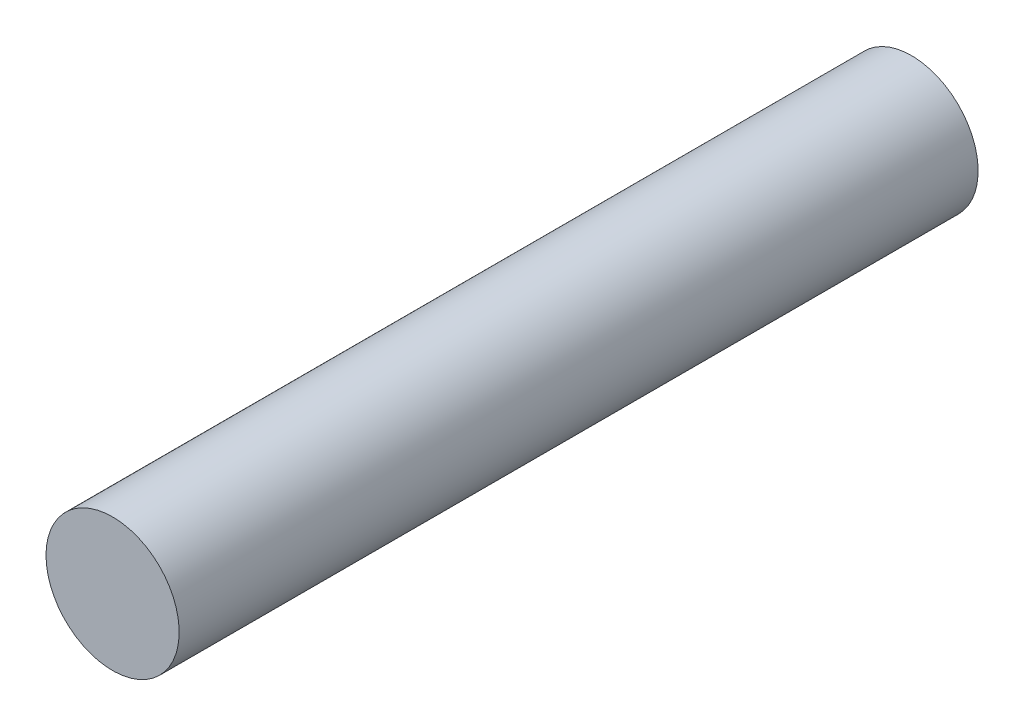
from build123d import *

# Parameters (mm, degrees)
ESQUISSE1_R        = 3.175
BOSS_EXTRU_1_DEPTH = 38.1


with BuildPart() as part:
    # Esquisse1 → Boss.-Extru.1 (new body)
    with BuildSketch(Plane.XY):
        with Locations(Location((0, 0, 0), (0, 0, 180))):
            Circle(ESQUISSE1_R)
    extrude(amount=BOSS_EXTRU_1_DEPTH)


solid = part.part
